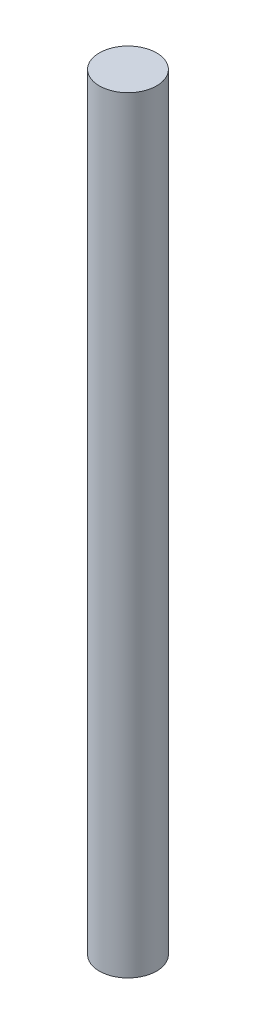
from build123d import *

# Parameters (mm, degrees)
SKETCH1_R           = 1.905
BOSS_EXTRUDE1_DEPTH = 51.054


with BuildPart() as part:
    # Sketch1 → Boss-Extrude1 (new body)
    with BuildSketch(Plane(origin=(0, 0, 0), x_dir=(1, 0, 0), z_dir=(0, 1, 0))):
        with Locations(Location((0, 0, 0), (0, 0, 270))):
            Circle(SKETCH1_R)
    extrude(amount=BOSS_EXTRUDE1_DEPTH)


solid = part.part
